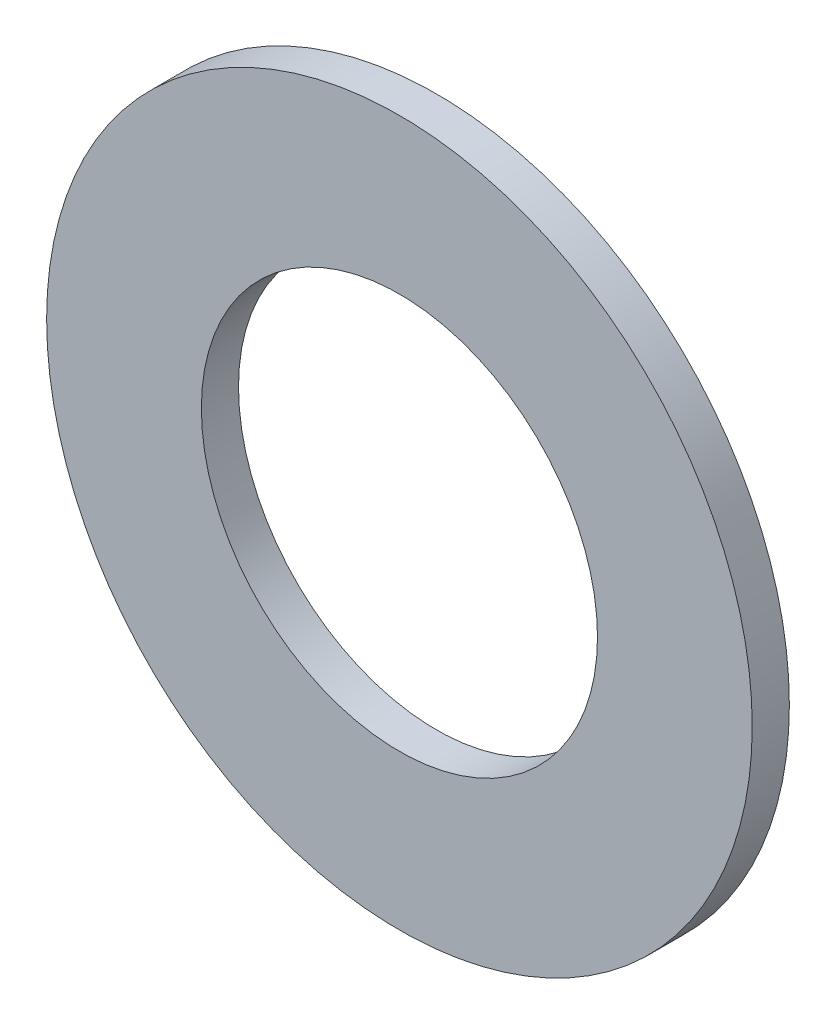
from build123d import *

# Parameters (mm, degrees)
SKETCH1_R           = 7.239
SKETCH1_R_2         = 4.064
BOSS_EXTRUDE1_DEPTH = 0.762


with BuildPart() as part:
    # Sketch1 → Boss-Extrude1 (new body)
    with BuildSketch(Plane.XY):
        with Locations(Location((0, 0, 0), (0, 0, 180))):
            Circle(SKETCH1_R)
        with Locations(Location((0, 0, 0), (0, 0, 180))):
            Circle(SKETCH1_R_2, mode=Mode.SUBTRACT)
    extrude(amount=BOSS_EXTRUDE1_DEPTH)


solid = part.part
